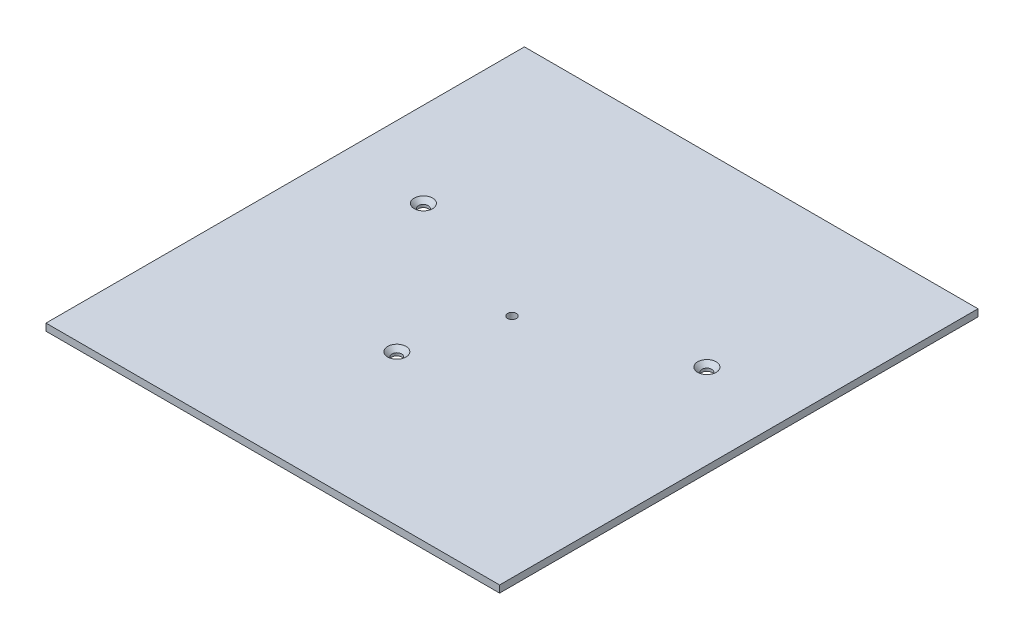
from build123d import *

# Parameters (mm, degrees)
SKETCH1_W                                      = 256
SKETCH1_H                                      = 270
BOSS_EXTRUDE1_DEPTH                            = 4
CSK_FOR_M5_FLAT_HEAD_MACHINE_SCREW1_AT_2_COUNT = 2
CSK_FOR_M5_FLAT_HEAD_MACHINE_SCREW1_AT_2_PITCH = 124.197423484
CSK_FOR_M5_FLAT_HEAD_MACHINE_SCREW1_AT_3_COUNT = 2
CSK_FOR_M5_FLAT_HEAD_MACHINE_SCREW1_AT_3_PITCH = 103.07764064
M6_TAPED_HOLE_THRMOCOUPLER_D                   = 5


with BuildPart() as part:
    # Sketch1 → Boss-Extrude1 (new body)
    with BuildSketch(Plane(origin=(0, 0, 0), x_dir=(1, 0, 0), z_dir=(0, 1, 0))):
        with Locations((128, 135)):
            Rectangle(SKETCH1_W, SKETCH1_H)
    extrude(amount=BOSS_EXTRUDE1_DEPTH)

    # Sketch2 → CSK for M5 Flat Head Machine Screw1 (revolve, cut)
    with BuildSketch(Plane(origin=(113, 4, -85), x_dir=(0, 0, 1), z_dir=(1, 0, 0))):
        Polygon((0, 0), (0, 4), (2.75, 4), (2.75, 2.45), (5.2, 0), align=None)
    csk_for_m5_flat_head_machine_screw1 = revolve(axis=Axis((113, 10.35, -85), (0, -1, 0)), mode=Mode.SUBTRACT)

    # CSK for M5 Flat Head Machine Screw1 at 2: CSK for M5 Flat Head Machine Screw1 ×2
    with Locations(*[Vector(0.7649111981170511, 0, -0.6441357457827795) * (i * CSK_FOR_M5_FLAT_HEAD_MACHINE_SCREW1_AT_2_PITCH) for i in range(1, CSK_FOR_M5_FLAT_HEAD_MACHINE_SCREW1_AT_2_COUNT)]):
        add(csk_for_m5_flat_head_machine_screw1, mode=Mode.SUBTRACT)

    # CSK for M5 Flat Head Machine Screw1 at 3: CSK for M5 Flat Head Machine Screw1 ×2
    with Locations(*[Vector(-0.6305926250944657, 0, -0.7761140001162656) * (i * CSK_FOR_M5_FLAT_HEAD_MACHINE_SCREW1_AT_3_PITCH) for i in range(1, CSK_FOR_M5_FLAT_HEAD_MACHINE_SCREW1_AT_3_COUNT)]):
        add(csk_for_m5_flat_head_machine_screw1, mode=Mode.SUBTRACT)

    # M6 taped hole - thrmocoupler (through all)
    with Locations(Plane(origin=(0, 4, 0), x_dir=(-1, 0, 0), z_dir=(0, 1, 0))):
        with Locations((-128, -135)):
            Hole(M6_TAPED_HOLE_THRMOCOUPLER_D / 2)


solid = part.part
